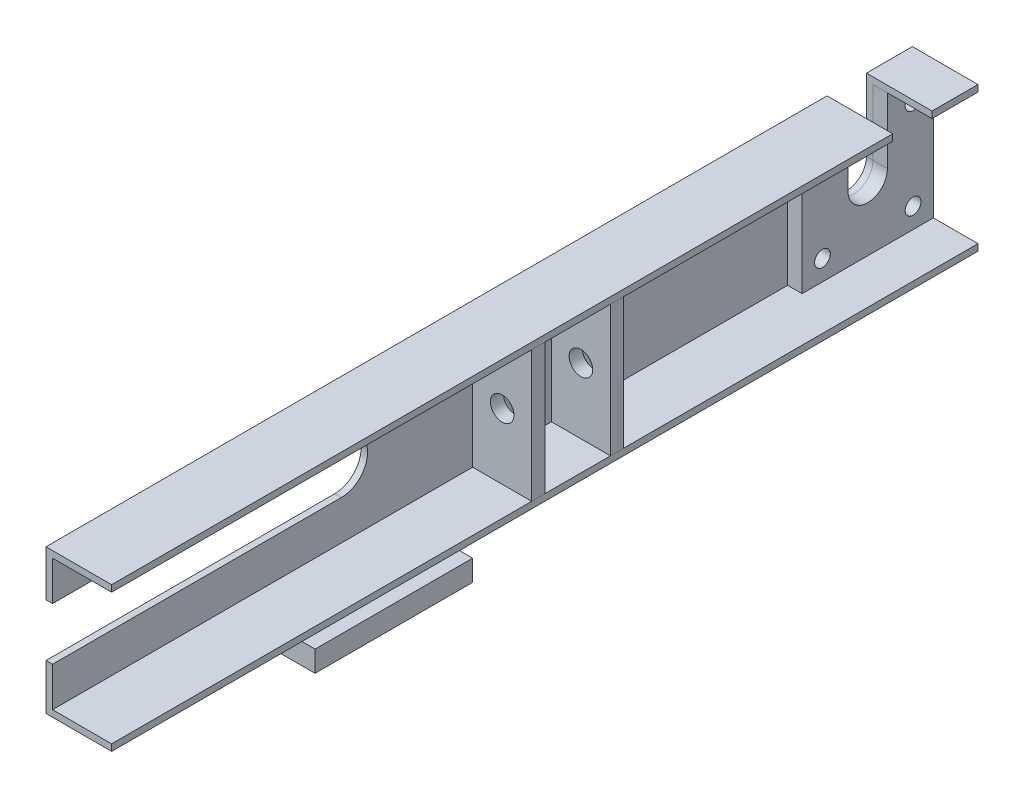
from build123d import *

# Parameters (mm, degrees)
C_CHANNEL_100_X_10_1_DEPTH = 660
BOSS_EXTRUDE1_REACH        = 351.893
SKETCH12_W                 = 45
SKETCH12_H                 = 10
CUT_EXTRUDE1_DEPTH         = 5
SKETCH17_W                 = 100
SKETCH17_H                 = 100
BOSS_EXTRUDE3_DEPTH        = 11
SKETCH15_W                 = 65
SKETCH15_H                 = 120
BOSS_EXTRUDE2_DEPTH        = 16
CUT_EXTRUDE2_DEPTH         = 343.002923964
CUT_EXTRUDE2_DEPTH_BACK    = 343.002923964
SKETCH19_R                 = 6
CUT_EXTRUDE4_DEPTH         = 25
SKETCH20_R                 = 5
CUT_EXTRUDE5_DEPTH         = 343.84252945
CUT_EXTRUDE7_REACH         = 354.478
SKETCH22_R                 = 9


with BuildPart() as part:
    # Sketch11 → C channel 100 X 10(1) (new body)
    with BuildSketch(Plane.YX.offset(-330)):
        Polygon((-55, 0), (55, 0), (55, 50), (50, 50), (50, 5), (-50, 5), (-50, 50), (-55, 50), align=None)
    extrude(amount=C_CHANNEL_100_X_10_1_DEPTH)


with BuildPart() as body_2:

    # Sketch12 → Boss-Extrude1 (new, up to next)
    with BuildSketch(Plane(origin=(0, -50, 0), x_dir=(1, 0, 0), z_dir=(0, 1, 0)), mode=Mode.PRIVATE) as boss_extrude1_sk1:
        with Locations((27.5, -5)):
            Rectangle(SKETCH12_W, SKETCH12_H)
    boss_extrude1_tool1 = extrude(boss_extrude1_sk1.sketch, amount=BOSS_EXTRUDE1_REACH, mode=Mode.PRIVATE) - part.part
    # Sketch12 → Boss-Extrude1 (new, up to next)
    with BuildSketch(Plane(origin=(0, -50, 0), x_dir=(1, 0, 0), z_dir=(0, 1, 0)), mode=Mode.PRIVATE) as boss_extrude1_sk2:
        with Locations((27.5, 55)):
            Rectangle(SKETCH12_W, SKETCH12_H)
    boss_extrude1_tool2 = extrude(boss_extrude1_sk2.sketch, amount=BOSS_EXTRUDE1_REACH, mode=Mode.PRIVATE) - part.part
    add(boss_extrude1_tool1.solids().sort_by_distance((27.5, -50, 5))[0])
    add(boss_extrude1_tool2.solids().sort_by_distance((27.5, -50, -55))[0])

    # Cut-Extrude7: up to this face of the body (flat: up to its plane)
    cut_extrude7_end = Plane(body_2.part.faces().sort_by_distance((27.5, 0, -60))[0])
    # Sketch22 → Cut-Extrude7 (cut, up to the picked face)
    with BuildSketch(Plane.XY.offset(10), mode=Mode.PRIVATE) as cut_extrude7_sk1:
        with Locations((27.5, 0)):
            Circle(SKETCH22_R)
    cut_extrude7_tool1 = split(extrude(cut_extrude7_sk1.sketch, amount=-CUT_EXTRUDE7_REACH, mode=Mode.PRIVATE), bisect_by=cut_extrude7_end, keep=Keep.BOTH, mode=Mode.PRIVATE)
    add(cut_extrude7_tool1.solids().sort_by(Axis((27.5, 0, 10), (0, 0, -1)))[0], mode=Mode.SUBTRACT)


with BuildPart() as part_1:
    add(part.part)

    # Sketch13 → Cut-Extrude1 (cut)
    with BuildSketch(Plane(origin=(5, 0, 0), x_dir=(0, 0, -1), z_dir=(1, 0, 0))):
        with BuildLine():
            Line((-330, 20), (-110, 20))
            ThreePointArc((-110, 20), (-90, 0), (-110, -20))
            Line((-110, -20), (-330, -20))
            Line((-330, -20), (-330, 20))
        make_face()
    extrude(amount=-CUT_EXTRUDE1_DEPTH, mode=Mode.SUBTRACT)


with BuildPart() as body_3:
    # Sketch17 → Boss-Extrude3 (new body)
    with BuildSketch(Plane(origin=(5, 0, 0), x_dir=(0, 0, -1), z_dir=(1, 0, 0))):
        with Locations((280, 0)):
            Rectangle(SKETCH17_W, SKETCH17_H)
    extrude(amount=BOSS_EXTRUDE3_DEPTH)


with BuildPart() as body_4:
    # Sketch15 → Boss-Extrude2 (new body)
    with BuildSketch(Plane.XZ.offset(55)):
        with Locations((27.5, 125)):
            Rectangle(SKETCH15_W, SKETCH15_H)
    extrude(amount=BOSS_EXTRUDE2_DEPTH)


with BuildPart() as cut_extrude2_tool:
    # Sketch14 → Cut-Extrude2 (new, two sides: drawn at the far end of the back side and taken through both)
    with BuildSketch(Plane(origin=(5, 0, 0), x_dir=(0, 0, -1), z_dir=(1, 0, 0)).offset(-CUT_EXTRUDE2_DEPTH_BACK)):
        with BuildLine():
            Line((265, 55), (265, 0))
            ThreePointArc((265, 0), (280, -15), (295, 0))
            Line((295, 0), (295, 55))
            Line((295, 55), (265, 55))
        make_face()
    extrude(amount=CUT_EXTRUDE2_DEPTH + CUT_EXTRUDE2_DEPTH_BACK)


with BuildPart() as part_2:
    add(part_1.part)

    # Cut-Extrude2: cut by cut_extrude2_tool
    add(cut_extrude2_tool.part, mode=Mode.SUBTRACT)

    # Sketch20 → Cut-Extrude5 (cut, through all)
    with BuildSketch(Plane.ZY):
        with Locations(Location((-25, 30, 0), (0, 0, 270))):
            Circle(SKETCH20_R)
        with Locations(Location((-120, 30, 0), (0, 0, 270))):
            Circle(SKETCH20_R)
    extrude(amount=-CUT_EXTRUDE5_DEPTH, mode=Mode.SUBTRACT)


with BuildPart() as body_3_1:
    add(body_3.part)

    # Cut-Extrude2: cut by cut_extrude2_tool
    add(cut_extrude2_tool.part, mode=Mode.SUBTRACT)

    # Sketch19 → Cut-Extrude4 (cut)
    with BuildSketch(Plane(origin=(30, 0, 0), x_dir=(0, 0, -1), z_dir=(1, 0, 0))):
        with Locations((314.5, -34.5)):
            Circle(SKETCH19_R)
        with Locations((245.5, -34.5)):
            Circle(SKETCH19_R)
        with Locations((314.5, 34.5)):
            Circle(SKETCH19_R)
        with Locations((245.5, 34.5)):
            Circle(SKETCH19_R)
    extrude(amount=-CUT_EXTRUDE4_DEPTH, mode=Mode.SUBTRACT)


solid = Compound([body_2.part, body_4.part, part_2.part, body_3_1.part])
